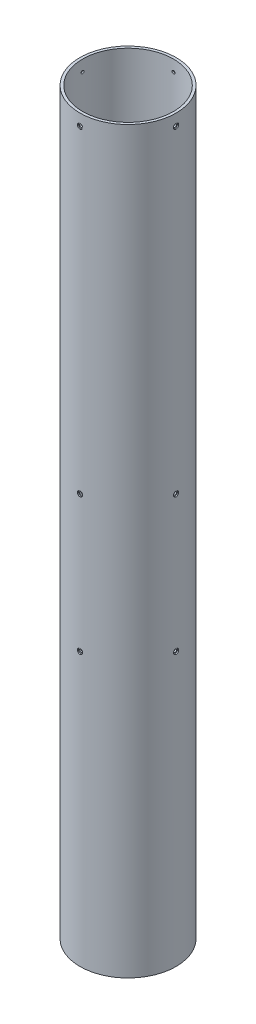
from build123d import *

# Parameters (mm, degrees)
SKETCH1_R                 = 53.721
SKETCH1_R_2               = 50.8
TUBE_EXTRUSION_DEPTH      = 825.5
BULKHEAD_HOLES_REACH      = 836.194
BULKHEAD_HOLES_END_RADIUS = 50.8
SKETCH3_R                 = 1.6383
HOLE_PATTERN_COUNT        = 4
SKETCH4_R                 = 2.9083
SKETCH4_R_2               = 1.6383
CUT_EXTRUDE1_DEPTH        = 1.27
CIRPATTERN1_COUNT         = 4


with BuildPart() as part:
    # Sketch1 → Tube Extrusion (new body)
    with BuildSketch(Plane(origin=(0, 0, 0), x_dir=(1, 0, 0), z_dir=(0, 1, 0))):
        Circle(SKETCH1_R)
        Circle(SKETCH1_R_2, mode=Mode.SUBTRACT)
    extrude(amount=TUBE_EXTRUSION_DEPTH)

    # Bulkhead Holes: up to this cylinder (the profile starts outside it)
    bulkhead_holes_end = Plane(origin=(0, 558.8, 0), z_dir=(0, -1, 0)) * Cylinder(BULKHEAD_HOLES_END_RADIUS, 2282.988, mode=Mode.PRIVATE)
    # Sketch3 → Bulkhead Holes (cut, up to the surface)
    with BuildSketch(Plane.XY.offset(53.721), mode=Mode.PRIVATE) as bulkhead_holes_sk1:
        with Locations((0, 457.2)):
            Circle(SKETCH3_R)
    bulkhead_holes_tool1 = extrude(bulkhead_holes_sk1.sketch, amount=-BULKHEAD_HOLES_REACH, mode=Mode.PRIVATE) - bulkhead_holes_end
    # Sketch3 → Bulkhead Holes (cut, up to the surface)
    with BuildSketch(Plane.XY.offset(53.721), mode=Mode.PRIVATE) as bulkhead_holes_sk2:
        with Locations((0, 304.8)):
            Circle(SKETCH3_R)
    bulkhead_holes_tool2 = extrude(bulkhead_holes_sk2.sketch, amount=-BULKHEAD_HOLES_REACH, mode=Mode.PRIVATE) - bulkhead_holes_end
    # Sketch3 → Bulkhead Holes (cut, up to the surface)
    with BuildSketch(Plane.XY.offset(53.721), mode=Mode.PRIVATE) as bulkhead_holes_sk3:
        with Locations((0, 812.8)):
            Circle(SKETCH3_R)
    bulkhead_holes_tool3 = extrude(bulkhead_holes_sk3.sketch, amount=-BULKHEAD_HOLES_REACH, mode=Mode.PRIVATE) - bulkhead_holes_end
    bulkhead_holes = bulkhead_holes_tool1.solids().sort_by_distance((0, 457.2, 53.721))[0] + bulkhead_holes_tool2.solids().sort_by_distance((0, 304.8, 53.721))[0] + bulkhead_holes_tool3.solids().sort_by_distance((0, 812.8, 53.721))[0]
    add(bulkhead_holes, mode=Mode.SUBTRACT)

    # Hole Pattern: Bulkhead Holes ×4 about axis
    hole_pattern_axis = Axis((0, 825.5, 0), (0, -1, 0))
    for i in range(1, HOLE_PATTERN_COUNT):
        add(bulkhead_holes.rotate(hole_pattern_axis, i * 360 / HOLE_PATTERN_COUNT), mode=Mode.SUBTRACT)

    # Sketch4 → Cut-Extrude1 (cut)
    # profile 1 of 3: a face of its own
    with BuildSketch(Plane.XY.offset(53.721)):
        with Locations((0, 812.8)):
            Circle(SKETCH4_R)
        with Locations((0, 812.8)):
            Circle(SKETCH4_R_2, mode=Mode.SUBTRACT)
    # profile 2 of 3: a face of its own
    with BuildSketch(Plane.XY.offset(53.721)):
        with Locations((0, 457.2)):
            Circle(SKETCH4_R)
        with Locations((0, 457.2)):
            Circle(SKETCH4_R_2, mode=Mode.SUBTRACT)
    # profile 3 of 3: a face of its own
    with BuildSketch(Plane.XY.offset(53.721)):
        with Locations((0, 304.8)):
            Circle(SKETCH4_R)
        with Locations((0, 304.8)):
            Circle(SKETCH4_R_2, mode=Mode.SUBTRACT)
    cut_extrude1 = extrude(amount=-CUT_EXTRUDE1_DEPTH, mode=Mode.SUBTRACT)

    # CirPattern1: Cut-Extrude1 ×4 about axis
    cirpattern1_axis = Axis((0, 0, 0), (0, 1, 0))
    for i in range(1, CIRPATTERN1_COUNT):
        add(cut_extrude1.rotate(cirpattern1_axis, i * 360 / CIRPATTERN1_COUNT), mode=Mode.SUBTRACT)


solid = part.part
